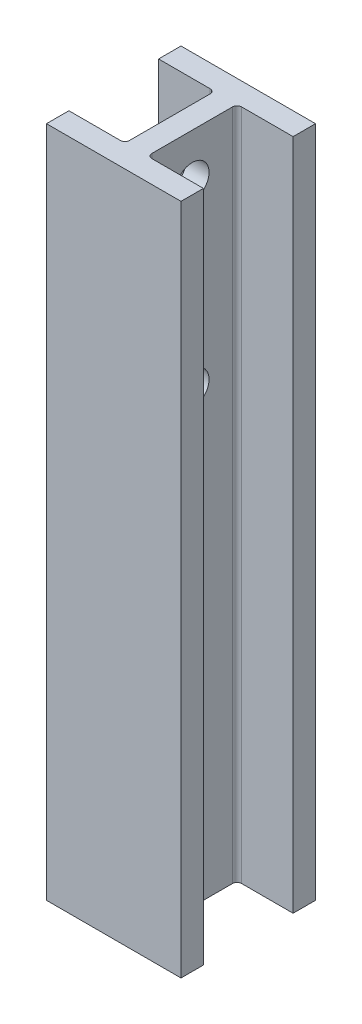
from build123d import *

# Parameters (mm, degrees)
BOSS_EXTRUDE1_DEPTH = 1500
FILLET1_R           = 10
SKETCH2_R           = 37.5
CUT_EXTRUDE1_DEPTH  = 1540.683409016


with BuildPart() as part:
    # Sketch1 → Boss-Extrude1 (new body)
    with BuildSketch(Plane(origin=(0, 0, 0), x_dir=(1, 0, 0), z_dir=(0, 1, 0))):
        Polygon((175, 50), (300, 50), (300, 0), (0, 0), (0, 50), (125, 50), (125, 250), (0, 250), (0, 300), (300, 300), (300, 250), (175, 250), align=None)
    extrude(amount=BOSS_EXTRUDE1_DEPTH)

    # Fillet1
    fillet1_edges = [part.edges().sort_by_distance(p)[0] for p in [
        (125, 750, -50),
        (125, 750, -250),
        (175, 750, -250),
        (175, 750, -50),
    ]]
    fillet(fillet1_edges, radius=FILLET1_R)

    # Sketch2 → Cut-Extrude1 (cut, through all)
    with BuildSketch(Plane.ZY.offset(-125)):
        with Locations((-150, 1400)):
            Circle(SKETCH2_R)
        with Locations((-150, 1000)):
            Circle(SKETCH2_R)
    extrude(amount=-CUT_EXTRUDE1_DEPTH, mode=Mode.SUBTRACT)


solid = part.part
